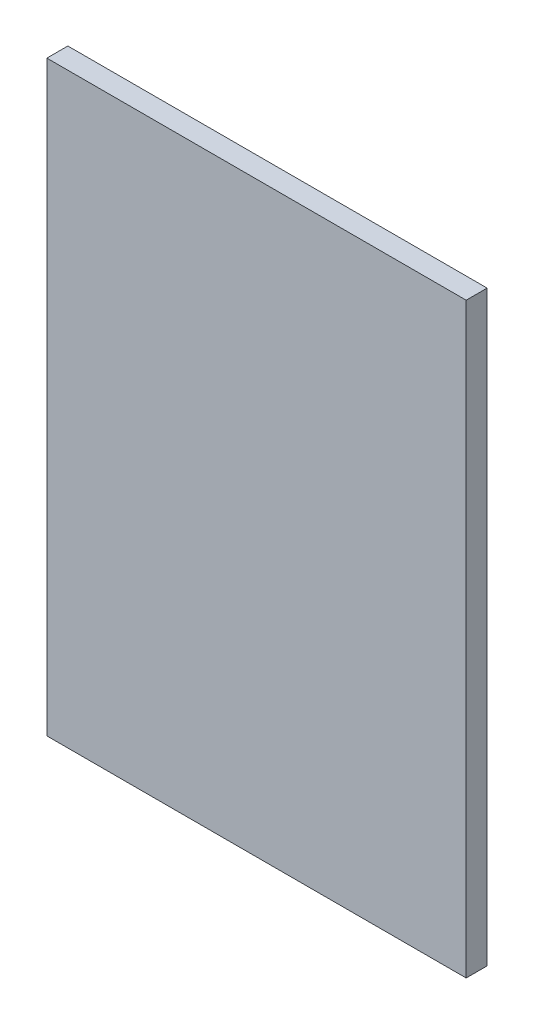
from build123d import *

# Parameters (mm, degrees)
SKETCH1_W           = 50
SKETCH1_H           = 70
BOSS_EXTRUDE1_DEPTH = 2.5


with BuildPart() as part:
    # Sketch1 → Boss-Extrude1 (new body)
    with BuildSketch(Plane.XY):
        Rectangle(SKETCH1_W, SKETCH1_H)
    extrude(amount=BOSS_EXTRUDE1_DEPTH)


solid = part.part
